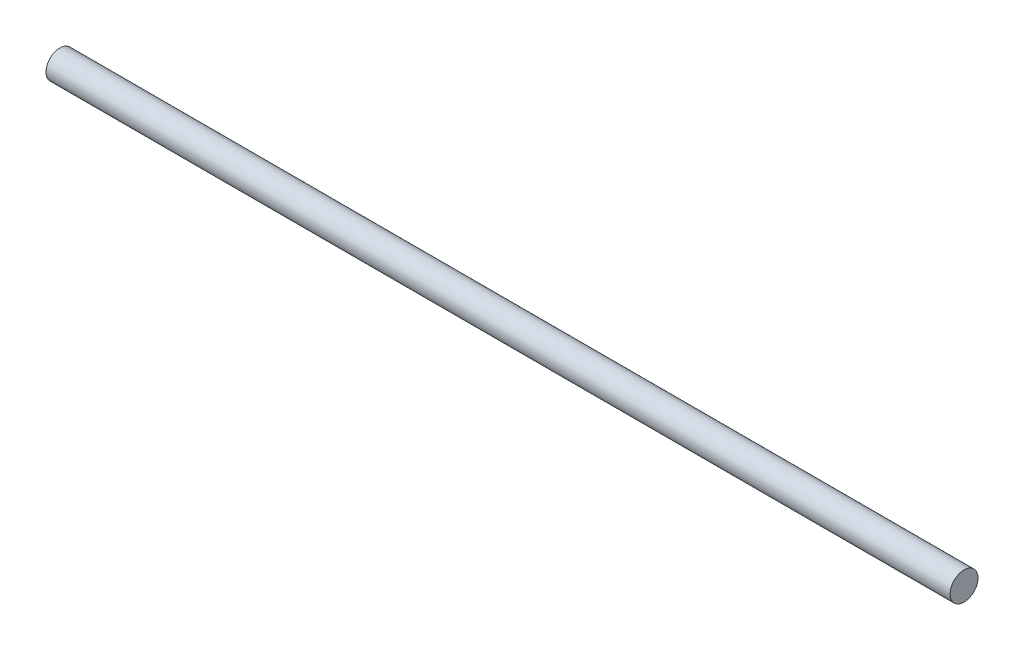
from build123d import *

# Parameters (mm, degrees)
SKETCH1_R           = 12.5
BOSS_EXTRUDE1_DEPTH = 405


with BuildPart() as part:
    # Sketch1 → Boss-Extrude1 (new, symmetric)
    with BuildSketch(Plane(origin=(0, 0, 0), x_dir=(0, 0, -1), z_dir=(1, 0, 0))):
        Circle(SKETCH1_R)
    extrude(amount=BOSS_EXTRUDE1_DEPTH, both=True)


solid = part.part
